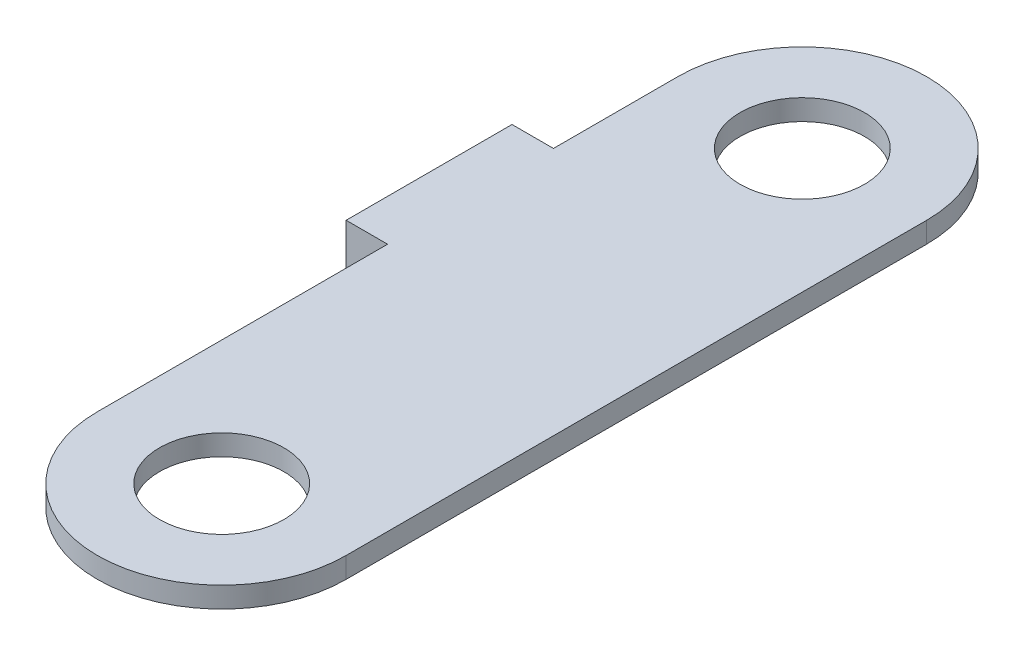
from build123d import *

# Parameters (mm, degrees)
SKETCH1_R           = 19.05
BOSS_EXTRUDE1_DEPTH = 6.35
SKETCH2_W           = 12.7
SKETCH2_H           = 50.8
BOSS_EXTRUDE4_DEPTH = 25.4


with BuildPart() as part:
    # Sketch1 → Boss-Extrude1 (new body)
    with BuildSketch(Plane(origin=(0, 0, 0), x_dir=(1, 0, 0), z_dir=(0, 1, 0))):
        with BuildLine():
            Line((-38.1, 0), (-38.1, -177.8))
            ThreePointArc((-38.1, -177.8), (0, -215.9), (38.1, -177.8))
            Line((38.1, -177.8), (38.1, 0))
            ThreePointArc((38.1, 0), (0, 38.1), (-38.1, 0))
        make_face()
        with Locations(Location((0, 0, 0), (0, 0, 270))):
            Circle(SKETCH1_R, mode=Mode.SUBTRACT)
        with Locations(Location((0, -177.8, 0), (0, 0, 270))):
            Circle(SKETCH1_R, mode=Mode.SUBTRACT)
    extrude(amount=BOSS_EXTRUDE1_DEPTH)

    # Sketch2 → Boss-Extrude4 (add)
    with BuildSketch(Plane(origin=(0, 6.35, 0), x_dir=(1, 0, 0), z_dir=(0, 1, 0))):
        with Locations((-44.45, -63.5)):
            Rectangle(SKETCH2_W, SKETCH2_H)
    extrude(amount=-BOSS_EXTRUDE4_DEPTH)


solid = part.part
